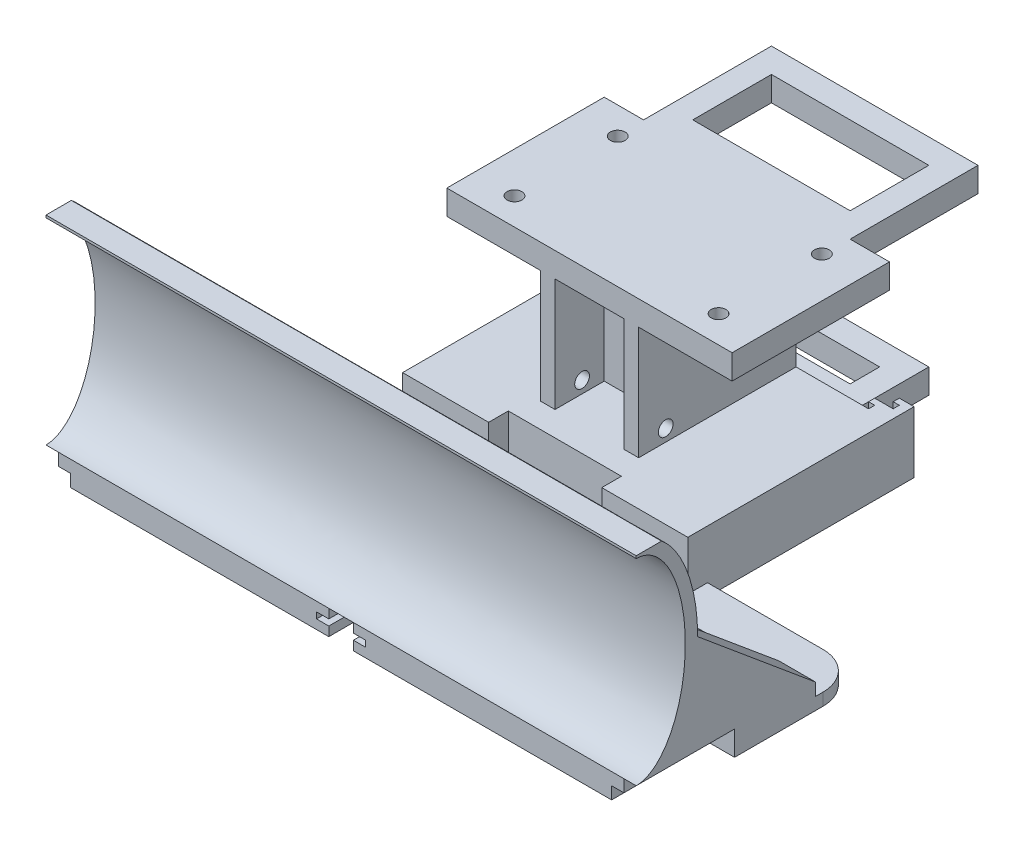
from build123d import *

# Parameters (mm, degrees)
BASE_CROQUIS_W                         = 120
BASE_CROQUIS_H                         = 120
BASE_SALIENTE_DEPTH                    = 5
ENCAJE_RUEDAS_CROQUIS_W                = 31
ENCAJE_RUEDAS_CROQUIS_H                = 57
ENCAJE_RUEDAS_CORTAR_DEPTH             = 5
CAJA_PLACAS_CROQUIS_1_W                = 58
CAJA_PLACAS_CROQUIS_1_H                = 42
CAJA_PLACAS_CROQUIS_1_W_2              = 42
CAJA_PLACAS_CROQUIS_1_H_2              = 32
CAJA_PLACAS_SALIENTE_1_DEPTH           = 5
CAJA_PLACAS_CROQUIS_2_W                = 42
CAJA_PLACAS_CROQUIS_2_H                = 32
CAJA_PLACAS_CORTAR_2_DEPTH             = 2.5
CAJA_PLACAS_CROQUIS_3_W                = 58
CAJA_PLACAS_CROQUIS_3_H                = 42
CAJA_PLACAS_SALIENTE_3_DEPTH           = 2.5
CAJA_PLACAS_CORTAR_4_DEPTH             = 7.5
CAJA_PLACAS_CROQUIS_5_W                = 31
CAJA_PLACAS_CROQUIS_5_H                = 21
CAJA_PLACAS_CORTAR_5_DEPTH             = 2.5
CAJA_MOTORES_CROQUIS_1_W               = 20
CAJA_MOTORES_CROQUIS_1_H               = 32
CAJA_MOTORES_SALIENTE_1_DEPTH          = 23
AGUJERO_TORNILLO_M3_CROQUIS_R          = 5
AGUJERO_TORNILLO_M3_CROQUIS_R_2        = 1.5
AGUJERO_TORNILLO_M3_CORTAR_DEPTH       = 20
CAJA_MOTORES_CROQUIS_2_W               = 58
CAJA_MOTORES_CROQUIS_2_H               = 32
CAJA_MOTORES_SALIENTE_2_DEPTH          = 5
AJUGERO_TUERCAS_M3_CROQUIS_W           = 14
AJUGERO_TUERCAS_M3_CROQUIS_H           = 23
AJUGERO_TUERCAS_M3_CORTAR_DEPTH        = 10
AGUJER_PCB_TARUGO_CROQUIS_R            = 1.5
AGUJER_PCB_TARUGO_CORTAR_DEPTH         = 3
CROQUIS13_W                            = 42
CROQUIS13_H                            = 26
CROQUIS13_W_2                          = 32
CROQUIS13_H_2                          = 16
CAJA_BATERIA_SALIENTE_DEPTH            = 5
CAJA_PLACAS_LATERALES_CROQUIS_1_W      = 41
CAJA_PLACAS_LATERALES_CROQUIS_1_H      = 31
CAJA_PLACAS_LATERALES_CORTAR_1_DEPTH   = 2.5
CAJA_PLACAS_LATERALES_CROQUIS_2_W      = 7.5
CAJA_PLACAS_LATERALES_CROQUIS_2_H      = 5
CAJA_PLACAS_LATERALES_CORTAR_2_DEPTH   = 2.5
CAJA_PLACAS_LATERALES_CROQUIS_3_W      = 31
CAJA_PLACAS_LATERALES_CROQUIS_3_H      = 21
CAJA_PLACAS_LATERALES_CORTAR_3_DEPTH   = 2.5
PARACHOQUES_SALIENTE_1_DEPTH           = 120
PARACHOQUES_SALIENTE_2_DEPTH           = 7.5
PARACHOQUES_SALIENTE_3_DEPTH           = 7.5
PARACHOQUES_SALIENTE_4_START           = 11.5
PARACHOQUES_SALIENTE_4_DEPTH           = 5
PARACHOQUES_SALIENTE_5_DEPTH           = 3.75
PARACHOQUES_SALIENTE_5_DEPTH_BACK      = 3.75
PARACHOQUES_SALIENTE_6_START           = -11.5
PARACHOQUES_SALIENTE_6_DEPTH           = 5
CROQUIS12_W                            = 120
CROQUIS12_H                            = 17.5
ENCAJE_CUCHILLA_CORTAR_1_DEPTH         = 5
ENCAJE_CUCHILLA_LATERAL_CROQUIS_1_W    = 5
ENCAJE_CUCHILLA_LATERAL_CROQUIS_1_H    = 20
ENCAJE_CUCHILLA_LATERAL_CORTAR_1_DEPTH = 2.5
ENCAJE_CUCHILLA_LATERAL_CROQUIS_2_W    = 2.5
ENCAJE_CUCHILLA_LATERAL_CROQUIS_2_H    = 20
ENCAJE_CUCHILLA_LATERAL_CORTAR_2_DEPTH = 2.5
ENCAJE_CUCHILLA_LATERAL_CROQUIS_3_W    = 2.5
ENCAJE_CUCHILLA_LATERAL_CROQUIS_3_H    = 1.25
ENCAJE_CUCHILLA_LATERAL_CORTAR_3_DEPTH = 1.25
ENCAJE_CUCHILLA_LATERAL_CROQUIS_4_W    = 2.5
ENCAJE_CUCHILLA_LATERAL_CROQUIS_4_H    = 1.25
ENCAJE_CUCHILLA_LATERAL_CORTAR_4_DEPTH = 1.25
ENCAJE_CUCHILLA_LATERAL_CROQUIS_5_W    = 2.5
ENCAJE_CUCHILLA_LATERAL_CROQUIS_5_H    = 1.25
ENCAJE_CUCHILLA_LATERAL_CORTAR_5_DEPTH = 1.25
ENCAJE_CUCHILLA_LATERAL_CROQUIS_6_W    = 2.5
ENCAJE_CUCHILLA_LATERAL_CROQUIS_6_H    = 1.25
ENCAJE_CUCHILLA_LATERAL_CORTAR_6_DEPTH = 1.25
ENCAJE_CUCHILLA_CENTRAL_CORTAR_DEPTH   = 20
CROQUIS14_W                            = 13
CROQUIS14_H                            = 15
DETALLES_AJUSTES_1_DEPTH               = 5
CROQUIS15_W                            = 32
CROQUIS15_H                            = 1
DETALLES_AJUSTES_2_DEPTH               = 5
CROQUIS16_W                            = 22
CROQUIS16_H                            = 6
DETALLES_AJUSTES_3_DEPTH               = 5
CROQUIS17_W                            = 17.5
CROQUIS17_H                            = 4
DETALLES_AJUSTES_4_DEPTH               = 7.5
CROQUIS18_W                            = 31
CROQUIS18_H                            = 4
DETALLES_AJUSTES_5_DEPTH               = 2.5
DETALLES_AJUSTES_6_DEPTH               = 2.5


with BuildPart() as part:
    # Base-Croquis → Base-Saliente (new body)
    with BuildSketch(Plane(origin=(0, 0, 0), x_dir=(1, 0, 0), z_dir=(0, 1, 0))):
        Rectangle(BASE_CROQUIS_W, BASE_CROQUIS_H)
    extrude(amount=BASE_SALIENTE_DEPTH)

    # Encaje-Ruedas-Croquis → Encaje-Ruedas-Cortar (cut)
    with BuildSketch(Plane(origin=(0, 5, 0), x_dir=(1, 0, 0), z_dir=(0, 1, 0))):
        with Locations((44.5, 31.5)):
            Rectangle(ENCAJE_RUEDAS_CROQUIS_W, ENCAJE_RUEDAS_CROQUIS_H)
        with Locations((-44.5, 31.5)):
            Rectangle(ENCAJE_RUEDAS_CROQUIS_W, ENCAJE_RUEDAS_CROQUIS_H)
    extrude(amount=-ENCAJE_RUEDAS_CORTAR_DEPTH, mode=Mode.SUBTRACT)

    # Caja-Placas-Croquis-1 → Caja-Placas-Saliente-1 (add)
    with BuildSketch(Plane(origin=(0, 5, 0), x_dir=(1, 0, 0), z_dir=(0, 1, 0))):
        with Locations((0, 24)):
            Rectangle(CAJA_PLACAS_CROQUIS_1_W, CAJA_PLACAS_CROQUIS_1_H)
        with Locations((0, 24)):
            Rectangle(CAJA_PLACAS_CROQUIS_1_W_2, CAJA_PLACAS_CROQUIS_1_H_2, mode=Mode.SUBTRACT)
    extrude(amount=CAJA_PLACAS_SALIENTE_1_DEPTH)

    # Caja-Placas-Croquis-2 → Caja-Placas-Cortar-2 (cut)
    with BuildSketch(Plane(origin=(0, 5, 0), x_dir=(1, 0, 0), z_dir=(0, 1, 0))):
        with Locations((0, 24)):
            Rectangle(CAJA_PLACAS_CROQUIS_2_W, CAJA_PLACAS_CROQUIS_2_H)
    extrude(amount=-CAJA_PLACAS_CORTAR_2_DEPTH, mode=Mode.SUBTRACT)

    # Caja-Placas-Croquis-3 → Caja-Placas-Saliente-3 (add)
    with BuildSketch(Plane(origin=(0, 10, 0), x_dir=(1, 0, 0), z_dir=(0, 1, 0))):
        with Locations((0, 24)):
            Rectangle(CAJA_PLACAS_CROQUIS_3_W, CAJA_PLACAS_CROQUIS_3_H)
    extrude(amount=CAJA_PLACAS_SALIENTE_3_DEPTH)

    # Caja-Placas-Croquis-4 → Caja-Placas-Cortar-4 (cut)
    with BuildSketch(Plane(origin=(0, 12.5, 0), x_dir=(1, 0, 0), z_dir=(0, 1, 0))):
        Polygon((23.5, 42.5), (26, 42.5), (27.25, 42.5), (27.25, 43.75), (26, 43.75), (26, 45), (-26, 45), (-26, 43.75), (-27.25, 43.75), (-27.25, 42.5), (-26, 42.5), (-23.5, 42.5), (-23.5, 41.25), (-24.75, 41.25), (-24.75, 40), (-23.5, 40), (23.5, 40), (24.75, 40), (24.75, 41.25), (23.5, 41.25), align=None)
    extrude(amount=-CAJA_PLACAS_CORTAR_4_DEPTH, mode=Mode.SUBTRACT)

    # Caja-Placas-Croquis-5 → Caja-Placas-Cortar-5 (cut)
    with BuildSketch(Plane(origin=(0, 0, 0), x_dir=(-1, 0, 0), z_dir=(0, -1, 0))):
        with Locations((0, 24)):
            Rectangle(CAJA_PLACAS_CROQUIS_5_W, CAJA_PLACAS_CROQUIS_5_H)
    extrude(amount=-CAJA_PLACAS_CORTAR_5_DEPTH, mode=Mode.SUBTRACT)

    # Caja-Motores-Croquis-1 → Caja-Motores-Saliente-1 (add)
    with BuildSketch(Plane(origin=(0, 12.5, 0), x_dir=(1, 0, 0), z_dir=(0, 1, 0))):
        with Locations((0, 24)):
            Rectangle(CAJA_MOTORES_CROQUIS_1_W, CAJA_MOTORES_CROQUIS_1_H)
    extrude(amount=CAJA_MOTORES_SALIENTE_1_DEPTH)

    # Agujero-Tornillo-M3-Croquis → Agujero-Tornillo-M3-Cortar (cut)
    with BuildSketch(Plane(origin=(10, 0, 0), x_dir=(0, 0, -1), z_dir=(1, 0, 0))):
        with Locations((33.5, 23.7)):
            Circle(AGUJERO_TORNILLO_M3_CROQUIS_R)
        with Locations((13.5, 32.45)):
            Circle(AGUJERO_TORNILLO_M3_CROQUIS_R_2)
        with Locations((13.5, 14.95)):
            Circle(AGUJERO_TORNILLO_M3_CROQUIS_R_2)
    extrude(amount=-AGUJERO_TORNILLO_M3_CORTAR_DEPTH, mode=Mode.SUBTRACT)

    # Caja-Motores-Croquis-2 → Caja-Motores-Saliente-2 (add)
    with BuildSketch(Plane(origin=(0, 35.5, 0), x_dir=(1, 0, 0), z_dir=(0, 1, 0))):
        with Locations((0, 24)):
            Rectangle(CAJA_MOTORES_CROQUIS_2_W, CAJA_MOTORES_CROQUIS_2_H)
    extrude(amount=CAJA_MOTORES_SALIENTE_2_DEPTH)

    # Ajugero-Tuercas-M3-Croquis → Ajugero-Tuercas-M3-Cortar (cut)
    with BuildSketch(Plane.XY.offset(-8)):
        with Locations((0, 24)):
            Rectangle(AJUGERO_TUERCAS_M3_CROQUIS_W, AJUGERO_TUERCAS_M3_CROQUIS_H)
    extrude(amount=-AJUGERO_TUERCAS_M3_CORTAR_DEPTH, mode=Mode.SUBTRACT)

    # Agujer-PCB-Tarugo-Croquis → Agujer-PCB-Tarugo-Cortar (cut)
    with BuildSketch(Plane(origin=(0, 40.5, 0), x_dir=(1, 0, 0), z_dir=(0, 1, 0))):
        with Locations(Location((-20.75, 34.5, 0), (0, 0, 270))):
            Circle(AGUJER_PCB_TARUGO_CROQUIS_R)
        with Locations(Location((20.75, 34.5, 0), (0, 0, 90))):
            Circle(AGUJER_PCB_TARUGO_CROQUIS_R)
        with Locations(Location((-20.75, 13.5, 0), (0, 0, 90))):
            Circle(AGUJER_PCB_TARUGO_CROQUIS_R)
        with Locations(Location((20.75, 13.5, 0), (0, 0, 270))):
            Circle(AGUJER_PCB_TARUGO_CROQUIS_R)
    extrude(amount=-AGUJER_PCB_TARUGO_CORTAR_DEPTH, mode=Mode.SUBTRACT)

    # Croquis13 → Caja-Bateria-Saliente (add)
    with BuildSketch(Plane(origin=(0, 40.5, 0), x_dir=(1, 0, 0), z_dir=(0, 1, 0))):
        with Locations((0, 53)):
            Rectangle(CROQUIS13_W, CROQUIS13_H)
        with Locations((0, 53)):
            Rectangle(CROQUIS13_W_2, CROQUIS13_H_2, mode=Mode.SUBTRACT)
    extrude(amount=-CAJA_BATERIA_SALIENTE_DEPTH)

    # Caja-Placas-Laterales-Croquis-1 → Caja-Placas-Laterales-Cortar-1 (cut)
    with BuildSketch(Plane(origin=(0, 5, 0), x_dir=(1, 0, 0), z_dir=(0, 1, 0))):
        with Locations((-32, -16.5)):
            Rectangle(CAJA_PLACAS_LATERALES_CROQUIS_1_W, CAJA_PLACAS_LATERALES_CROQUIS_1_H)
        with Locations((32, -16.5)):
            Rectangle(CAJA_PLACAS_LATERALES_CROQUIS_1_W, CAJA_PLACAS_LATERALES_CROQUIS_1_H)
    extrude(amount=-CAJA_PLACAS_LATERALES_CORTAR_1_DEPTH, mode=Mode.SUBTRACT)

    # Caja-Placas-Laterales-Croquis-2 → Caja-Placas-Laterales-Cortar-2 (cut)
    with BuildSketch(Plane(origin=(0, 5, 0), x_dir=(1, 0, 0), z_dir=(0, 1, 0))):
        with Locations((56.25, -3.5)):
            Rectangle(CAJA_PLACAS_LATERALES_CROQUIS_2_W, CAJA_PLACAS_LATERALES_CROQUIS_2_H)
        with Locations((-56.25, -3.5)):
            Rectangle(CAJA_PLACAS_LATERALES_CROQUIS_2_W, CAJA_PLACAS_LATERALES_CROQUIS_2_H)
    extrude(amount=-CAJA_PLACAS_LATERALES_CORTAR_2_DEPTH, mode=Mode.SUBTRACT)

    # Caja-Placas-Laterales-Croquis-3 → Caja-Placas-Laterales-Cortar-3 (cut)
    with BuildSketch(Plane(origin=(0, 2.5, 0), x_dir=(1, 0, 0), z_dir=(0, 1, 0))):
        with Locations((32, -16.5)):
            Rectangle(CAJA_PLACAS_LATERALES_CROQUIS_3_W, CAJA_PLACAS_LATERALES_CROQUIS_3_H)
        with Locations((-32, -16.5)):
            Rectangle(CAJA_PLACAS_LATERALES_CROQUIS_3_W, CAJA_PLACAS_LATERALES_CROQUIS_3_H)
    extrude(amount=-CAJA_PLACAS_LATERALES_CORTAR_3_DEPTH, mode=Mode.SUBTRACT)

    # Parachoques-Croquis-1 → Parachoques-Saliente-1 (add)
    with BuildSketch(Plane(origin=(60, 0, 0), x_dir=(0, 0, -1), z_dir=(1, 0, 0))):
        with BuildLine():
            Line((-42.5, 5), (-36.773464409, 5))
            add(Edge.make_bspline(
                [(-36.773464409, 5), (-13.792451774, 26.319457057), (-37.347989725, 45.5)],
                knots=[0.47588225, 0.47588225, 0.47588225, 2.716768226, 2.716768226, 2.716768226], degree=2, weights=[1, 0.43528367, 1]))
            Line((-37.347989725, 45.5), (-42.5, 45.5))
            Line((-42.5, 45.5), (-42.5, 45))
            add(Edge.make_bspline(
                [(-42.5, 5), (-32.5, 5), (-32.5, 25), (-32.5, 45), (-42.5, 45)],
                knots=[3.141592654, 3.141592654, 3.141592654, 4.71238898, 4.71238898, 6.283185307, 6.283185307, 6.283185307], degree=2, weights=[1, 0.707106781, 1, 0.707106781, 1]))
        make_face()
    extrude(amount=-PARACHOQUES_SALIENTE_1_DEPTH)

    # Parachoques-Croquis-2 → Parachoques-Saliente-2 (add)
    with BuildSketch(Plane(origin=(60, 0, 0), x_dir=(0, 0, -1), z_dir=(1, 0, 0))):
        with BuildLine():
            Line((-30, 25), (-6, 5))
            Line((-6, 5), (-36.773464409, 5))
            add(Edge.make_bspline(
                [(-36.773464409, 5), (-30, 11.283734572), (-30, 25)],
                knots=[0.47588225, 0.47588225, 0.47588225, 1.570796327, 1.570796327, 1.570796327], degree=2, weights=[1, 0.853850938, 1]))
        make_face()
    extrude(amount=-PARACHOQUES_SALIENTE_2_DEPTH)

    # Parachoques-Croquis-3 → Parachoques-Saliente-3 (add)
    with BuildSketch(Plane.ZY.offset(60)):
        with BuildLine():
            Line((6, 5), (30, 25))
            add(Edge.make_bspline(
                [(30, 25), (30, 11.283734572), (36.773464409, 5)],
                knots=[4.71238898, 4.71238898, 4.71238898, 5.807303058, 5.807303058, 5.807303058], degree=2, weights=[1, 0.853850938, 1]))
            Line((36.773464409, 5), (6, 5))
        make_face()
    extrude(amount=-PARACHOQUES_SALIENTE_3_DEPTH)

    # Parachoques-Croquis-4 → Parachoques-Saliente-4 (add)
    with BuildSketch(Plane(origin=(0, 0, 0), x_dir=(0, 0, -1), z_dir=(1, 0, 0)).offset(PARACHOQUES_SALIENTE_4_START)):
        with BuildLine():
            Line((-6, 5), (-30, 25))
            add(Edge.make_bspline(
                [(-36.773464409, 5), (-30, 11.283734572), (-30, 25)],
                knots=[0.47588225, 0.47588225, 0.47588225, 1.570796327, 1.570796327, 1.570796327], degree=2, weights=[1, 0.853850938, 1]))
            Line((-36.773464409, 5), (-6, 5))
        make_face()
    extrude(amount=-PARACHOQUES_SALIENTE_4_DEPTH)

    # Parachoques-Croquis-6 → Parachoques-Saliente-5 (add, two sides: drawn at the far end of the back side and taken through both)
    with BuildSketch(Plane(origin=(0, 0, 0), x_dir=(0, 0, -1), z_dir=(1, 0, 0)).offset(-PARACHOQUES_SALIENTE_5_DEPTH_BACK)):
        with BuildLine():
            Line((-6, 5), (-30, 25))
            add(Edge.make_bspline(
                [(-36.773464409, 5), (-30, 11.283734572), (-30, 25)],
                knots=[0.47588225, 0.47588225, 0.47588225, 1.570796327, 1.570796327, 1.570796327], degree=2, weights=[1, 0.853850938, 1]))
            Line((-36.773464409, 5), (-6, 5))
        make_face()
    extrude(amount=PARACHOQUES_SALIENTE_5_DEPTH + PARACHOQUES_SALIENTE_5_DEPTH_BACK)

    # Croquis9<2> → Parachoques-Saliente-6 (add)
    with BuildSketch(Plane(origin=(0, 0, 0), x_dir=(0, 0, -1), z_dir=(1, 0, 0)).offset(PARACHOQUES_SALIENTE_6_START)):
        with BuildLine():
            Line((-6, 5), (-30, 25))
            add(Edge.make_bspline(
                [(-36.773464409, 5), (-30, 11.283734572), (-30, 25)],
                knots=[0.47588225, 0.47588225, 0.47588225, 1.570796327, 1.570796327, 1.570796327], degree=2, weights=[1, 0.853850938, 1]))
            Line((-36.773464409, 5), (-6, 5))
        make_face()
    extrude(amount=PARACHOQUES_SALIENTE_6_DEPTH)

    # Croquis12 → Encaje-Cuchilla-Cortar-1 (cut)
    with BuildSketch(Plane(origin=(0, 5, 0), x_dir=(1, 0, 0), z_dir=(0, 1, 0))):
        with Locations((0, -51.25)):
            Rectangle(CROQUIS12_W, CROQUIS12_H)
    extrude(amount=-ENCAJE_CUCHILLA_CORTAR_1_DEPTH, mode=Mode.SUBTRACT)

    # Encaje-Cuchilla-Lateral-Croquis-1 → Encaje-Cuchilla-Lateral-Cortar-1 (cut)
    with BuildSketch(Plane.XZ):
        with Locations((57.5, 32.5)):
            Rectangle(ENCAJE_CUCHILLA_LATERAL_CROQUIS_1_W, ENCAJE_CUCHILLA_LATERAL_CROQUIS_1_H)
        with Locations((-57.5, 32.5)):
            Rectangle(ENCAJE_CUCHILLA_LATERAL_CROQUIS_1_W, ENCAJE_CUCHILLA_LATERAL_CROQUIS_1_H)
    extrude(amount=-ENCAJE_CUCHILLA_LATERAL_CORTAR_1_DEPTH, mode=Mode.SUBTRACT)

    # Encaje-Cuchilla-Lateral-Croquis-2 → Encaje-Cuchilla-Lateral-Cortar-2 (cut)
    with BuildSketch(Plane.XZ.offset(-2.5)):
        with Locations((58.75, 32.5)):
            Rectangle(ENCAJE_CUCHILLA_LATERAL_CROQUIS_2_W, ENCAJE_CUCHILLA_LATERAL_CROQUIS_2_H)
        with Locations((-58.75, 32.5)):
            Rectangle(ENCAJE_CUCHILLA_LATERAL_CROQUIS_2_W, ENCAJE_CUCHILLA_LATERAL_CROQUIS_2_H)
    extrude(amount=-ENCAJE_CUCHILLA_LATERAL_CORTAR_2_DEPTH, mode=Mode.SUBTRACT)

    # Encaje-Cuchilla-Lateral-Croquis-3 → Encaje-Cuchilla-Lateral-Cortar-3 (cut)
    with BuildSketch(Plane(origin=(57.5, 0, 0), x_dir=(0, 0, -1), z_dir=(1, 0, 0))):
        with Locations((-23.75, 4.375)):
            Rectangle(ENCAJE_CUCHILLA_LATERAL_CROQUIS_3_W, ENCAJE_CUCHILLA_LATERAL_CROQUIS_3_H)
    extrude(amount=-ENCAJE_CUCHILLA_LATERAL_CORTAR_3_DEPTH, mode=Mode.SUBTRACT)

    # Encaje-Cuchilla-Lateral-Croquis-4 → Encaje-Cuchilla-Lateral-Cortar-4 (cut)
    with BuildSketch(Plane(origin=(55, 0, 0), x_dir=(0, 0, -1), z_dir=(1, 0, 0))):
        with Locations((-23.75, 1.875)):
            Rectangle(ENCAJE_CUCHILLA_LATERAL_CROQUIS_4_W, ENCAJE_CUCHILLA_LATERAL_CROQUIS_4_H)
    extrude(amount=-ENCAJE_CUCHILLA_LATERAL_CORTAR_4_DEPTH, mode=Mode.SUBTRACT)

    # Encaje-Cuchilla-Lateral-Croquis-5 → Encaje-Cuchilla-Lateral-Cortar-5 (cut)
    with BuildSketch(Plane.ZY.offset(57.5)):
        with Locations((23.75, 4.375)):
            Rectangle(ENCAJE_CUCHILLA_LATERAL_CROQUIS_5_W, ENCAJE_CUCHILLA_LATERAL_CROQUIS_5_H)
    extrude(amount=-ENCAJE_CUCHILLA_LATERAL_CORTAR_5_DEPTH, mode=Mode.SUBTRACT)

    # Encaje-Cuchilla-Lateral-Croquis-6 → Encaje-Cuchilla-Lateral-Cortar-6 (cut)
    with BuildSketch(Plane.ZY.offset(55)):
        with Locations((23.75, 1.875)):
            Rectangle(ENCAJE_CUCHILLA_LATERAL_CROQUIS_6_W, ENCAJE_CUCHILLA_LATERAL_CROQUIS_6_H)
    extrude(amount=-ENCAJE_CUCHILLA_LATERAL_CORTAR_6_DEPTH, mode=Mode.SUBTRACT)

    # Encaje-Cuchilla-Central-Croquis → Encaje-Cuchilla-Central-Cortar (cut)
    with BuildSketch(Plane.XY.offset(42.5)):
        Polygon((-2.5, 0), (2.5, 0), (2.5, 1.875), (5, 1.875), (5, 3.125), (2.5, 3.125), (2.5, 5), (-2.5, 5), (-2.5, 3.125), (-5, 3.125), (-5, 1.875), (-2.5, 1.875), align=None)
    extrude(amount=-ENCAJE_CUCHILLA_CENTRAL_CORTAR_DEPTH, mode=Mode.SUBTRACT)

    # Croquis14 → Detalles-Ajustes-1 (cut)
    with BuildSketch(Plane(origin=(0, 5, 0), x_dir=(1, 0, 0), z_dir=(0, 1, 0))):
        with Locations((-22.5, 52.5)):
            Rectangle(CROQUIS14_W, CROQUIS14_H)
        with Locations((22.5, 52.5)):
            Rectangle(CROQUIS14_W, CROQUIS14_H)
    extrude(amount=-DETALLES_AJUSTES_1_DEPTH, mode=Mode.SUBTRACT)

    # Croquis15 → Detalles-Ajustes-2 (add)
    with BuildSketch(Plane(origin=(0, 5, 0), x_dir=(1, 0, 0), z_dir=(0, 1, 0))):
        with Locations((0, 60.5)):
            Rectangle(CROQUIS15_W, CROQUIS15_H)
    extrude(amount=-DETALLES_AJUSTES_2_DEPTH)

    # Croquis16 → Detalles-Ajustes-3 (cut)
    with BuildSketch(Plane(origin=(0, 5, 0), x_dir=(1, 0, 0), z_dir=(0, 1, 0))):
        with Locations((0, 53)):
            Rectangle(CROQUIS16_W, CROQUIS16_H)
    extrude(amount=-DETALLES_AJUSTES_3_DEPTH, mode=Mode.SUBTRACT)

    # Croquis17 → Detalles-Ajustes-4 (add)
    with BuildSketch(Plane(origin=(0, 5, 0), x_dir=(1, 0, 0), z_dir=(0, 1, 0))):
        with Locations((-20.25, 1)):
            Rectangle(CROQUIS17_W, CROQUIS17_H)
        with Locations((20.25, 1)):
            Rectangle(CROQUIS17_W, CROQUIS17_H)
    extrude(amount=DETALLES_AJUSTES_4_DEPTH)

    # Croquis18 → Detalles-Ajustes-5 (cut)
    with BuildSketch(Plane(origin=(0, 5, 0), x_dir=(1, 0, 0), z_dir=(0, 1, 0))):
        with Locations((-44.5, 1)):
            Rectangle(CROQUIS18_W, CROQUIS18_H)
        with Locations((44.5, 1)):
            Rectangle(CROQUIS18_W, CROQUIS18_H)
    extrude(amount=-DETALLES_AJUSTES_5_DEPTH, mode=Mode.SUBTRACT)

    # Croquis19 → Detalles-Ajustes-6 (cut)
    with BuildSketch(Plane(origin=(0, 2.5, 0), x_dir=(1, 0, 0), z_dir=(0, 1, 0))):
        with BuildLine():
            Line((52.5, 3), (60, 3))
            Line((60, 3), (60, -4.5))
            ThreePointArc((60, -4.5), (57.803300859, 0.803300859), (52.5, 3))
        make_face()
        with BuildLine():
            Line((-60, 3), (-60, -4.5))
            ThreePointArc((-60, -4.5), (-57.803300859, 0.803300859), (-52.5, 3))
            Line((-52.5, 3), (-60, 3))
        make_face()
    extrude(amount=-DETALLES_AJUSTES_6_DEPTH, mode=Mode.SUBTRACT)


solid = part.part
